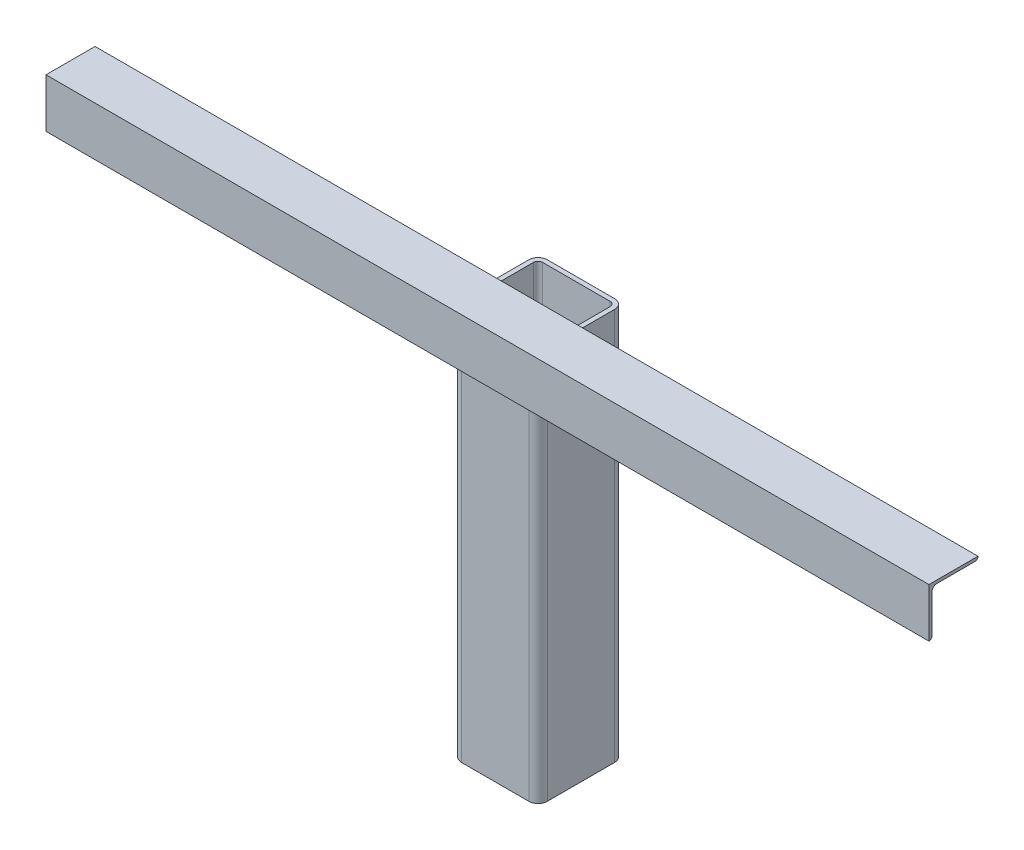
from build123d import *

# Parameters (mm, degrees)
VERTICAL_DEPTH = 406.4
CROSSBAR_DEPTH = 914.4


with BuildPart() as part:
    # Sketch12 → vertical (new body)
    with BuildSketch(Plane(origin=(0, 0, -44.45), x_dir=(1, 0, 0), z_dir=(0, 1, 0))):
        with BuildLine():
            Line((-34.925, -44.45), (34.925, -44.45))
            ThreePointArc((34.925, -44.45), (41.660192091, -41.660192091), (44.45, -34.925))
            Line((44.45, -34.925), (44.45, 34.925))
            ThreePointArc((44.45, 34.925), (41.660192091, 41.660192091), (34.925, 44.45))
            Line((34.925, 44.45), (-34.925, 44.45))
            ThreePointArc((-34.925, 44.45), (-41.660192091, 41.660192091), (-44.45, 34.925))
            Line((-44.45, 34.925), (-44.45, -34.925))
            ThreePointArc((-44.45, -34.925), (-41.660192091, -41.660192091), (-34.925, -44.45))
        make_face()
        with BuildLine():
            Line((-34.925, -39.6875), (34.925, -39.6875))
            ThreePointArc((34.925, -39.6875), (38.292596045, -38.292596045), (39.6875, -34.925))
            Line((39.6875, -34.925), (39.6875, 34.925))
            ThreePointArc((39.6875, 34.925), (38.292596045, 38.292596045), (34.925, 39.6875))
            Line((34.925, 39.6875), (-34.925, 39.6875))
            ThreePointArc((-34.925, 39.6875), (-38.292596045, 38.292596045), (-39.6875, 34.925))
            Line((-39.6875, 34.925), (-39.6875, -34.925))
            ThreePointArc((-39.6875, -34.925), (-38.292596045, -38.292596045), (-34.925, -39.6875))
        make_face(mode=Mode.SUBTRACT)
    extrude(amount=VERTICAL_DEPTH)


with BuildPart() as body_2:
    # Sketch13 → crossbar (new body)
    with BuildSketch(Plane(origin=(457.2, 409.575, 7.9375), x_dir=(0, 0, -1), z_dir=(-1, 0, 0))):
        with BuildLine():
            Line((0, 0), (0, 50.8))
            Line((0, 50.8), (0.00508, 50.8))
            ThreePointArc((0.00508, 50.8), (2.246551928, 49.871551928), (3.175, 47.63008))
            Line((3.175, 47.63008), (3.175, 7.9375))
            ThreePointArc((3.175, 7.9375), (4.569903955, 4.569903955), (7.9375, 3.175))
            Line((7.9375, 3.175), (47.63008, 3.175))
            ThreePointArc((47.63008, 3.175), (49.871551928, 2.246551928), (50.8, 0.00508))
            Line((50.8, 0.00508), (50.8, 0))
            Line((50.8, 0), (0, 0))
        make_face()
    extrude(amount=CROSSBAR_DEPTH)


solid = Compound([part.part, body_2.part])
